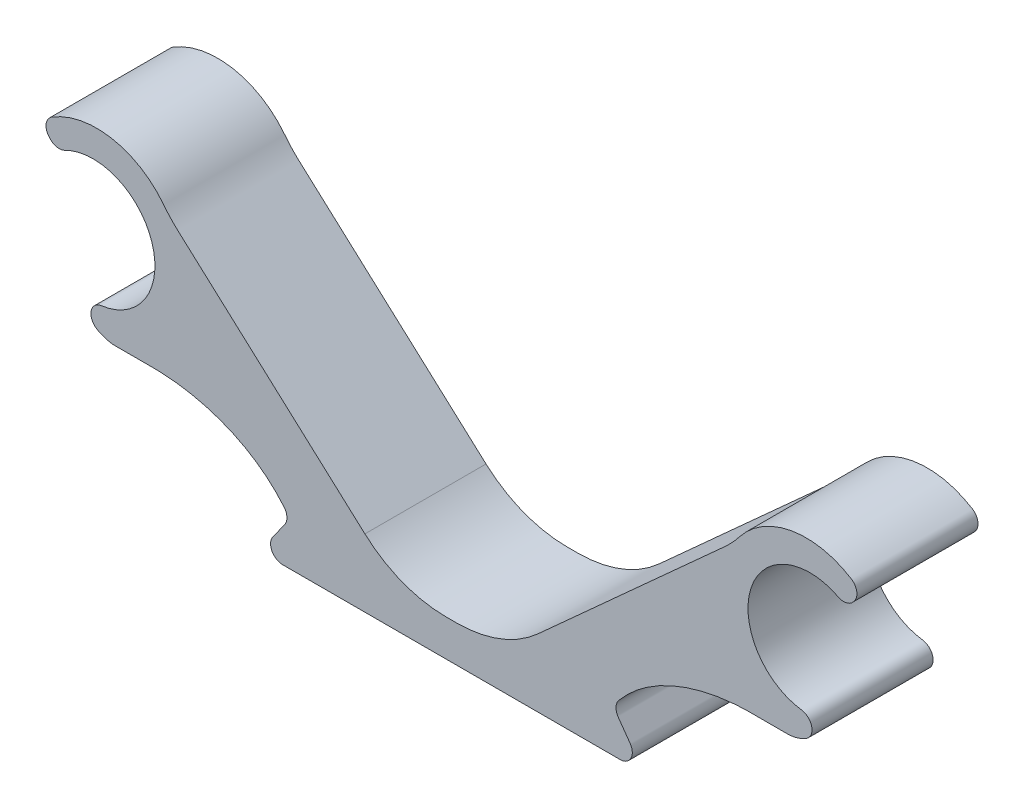
from build123d import *


with BuildPart() as part:
    # Sketch1 → Loft2 section 0
    with BuildSketch(Plane.XY):
        with BuildLine():
            Line((-14.749435925, 1.579146396), (-13.769485327, 2.95855378))
            ThreePointArc((-13.769485327, 2.95855378), (-13.585390404, 3.574613199), (-13.814433877, 4.175412031))
            add(Edge.make_bspline(
                [(-13.814433877, 4.175412031), (-14.417527952, 4.903873153), (-17.567781248, 7.791225194), (-22.06162275, 8.841915434), (-25.318719368, 8.741869045)],
                knots=[0.056598746, 0.056598746, 0.056598746, 0.056598746, 0.264504946, 1, 1, 1, 1], degree=3))
            Line((-25.318719368, 8.741869045), (-27.784310983, 8.741869045))
            add(Edge.make_bspline(
                [(-29.323229714, 9.211162218), (-28.911734347, 8.939401458), (-28.272403474, 8.743384076), (-27.784310983, 8.741869045)],
                knots=[0.586596628, 0.586596628, 0.586596628, 0.586596628, 1, 1, 1, 1], degree=3))
            ThreePointArc((-29.323229714, 9.211162218), (-29.747065132, 10.268151444), (-28.906559125, 11.036534382))
            ThreePointArc((-28.906559125, 11.036534382), (-24.721817141, 17.633736944), (-31.933702711, 20.637709922))
            ThreePointArc((-31.933702711, 20.637709922), (-32.573936169, 20.54323377), (-33.137949221, 20.860588307))
            Line((-33.137949221, 20.860588307), (-33.224181658, 20.957186689))
            ThreePointArc((-33.224181658, 20.957186689), (-33.468334903, 21.763124392), (-33.010324904, 22.46978784))
            ThreePointArc((-33.010324904, 22.46978784), (-28.072687528, 23.43565364), (-23.764465571, 20.837118829))
            ThreePointArc((-23.764465571, 20.837118829), (-23.196744837, 20.168506773), (-22.572618747, 19.552215012))
            Line((-22.572618747, 19.552215012), (-7.145865193, 5.601063972))
            ThreePointArc((-7.145865193, 5.601063972), (-4.032245088, 3.686045747), (-0.43842089, 3.017949499))
            Line((-0.43842089, 3.017949499), (0.43842089, 3.017949499))
            ThreePointArc((0.43842089, 3.017949499), (4.032245088, 3.686045747), (7.145865193, 5.601063972))
            Line((7.145865193, 5.601063972), (22.572618747, 19.552215012))
            ThreePointArc((22.572618747, 19.552215012), (23.196744837, 20.168506773), (23.764465571, 20.837118829))
            ThreePointArc((23.764465571, 20.837118829), (28.072687528, 23.43565364), (33.010324904, 22.46978784))
            ThreePointArc((33.010324904, 22.46978784), (33.468334903, 21.763124392), (33.224181658, 20.957186689))
            Line((33.224181658, 20.957186689), (33.137949221, 20.860588307))
            ThreePointArc((33.137949221, 20.860588307), (32.573936169, 20.54323377), (31.933702711, 20.637709922))
            ThreePointArc((31.933702711, 20.637709922), (24.721817141, 17.633736944), (28.906559125, 11.036534382))
            ThreePointArc((28.906559125, 11.036534382), (29.747065132, 10.268151444), (29.323229714, 9.211162218))
            add(Edge.make_bspline(
                [(29.323229714, 9.211162218), (28.911734347, 8.939401458), (28.272403474, 8.743384076), (27.784310983, 8.741869045)],
                knots=[0.586596628, 0.586596628, 0.586596628, 0.586596628, 1, 1, 1, 1], degree=3))
            Line((27.784310983, 8.741869045), (25.318719368, 8.741869045))
            add(Edge.make_bspline(
                [(13.814433877, 4.175412031), (14.417527952, 4.903873153), (17.567781248, 7.791225194), (22.06162275, 8.841915434), (25.318719368, 8.741869045)],
                knots=[0.056598746, 0.056598746, 0.056598746, 0.056598746, 0.264504946, 1, 1, 1, 1], degree=3))
            ThreePointArc((13.814433877, 4.175412031), (13.585390404, 3.574613199), (13.769485327, 2.95855378))
            Line((13.769485327, 2.95855378), (14.749435925, 1.579146396))
            ThreePointArc((14.749435925, 1.579146396), (14.822791679, 0.541276988), (13.934212365, 0))
            Line((13.934212365, 0), (-13.934212365, 0))
            ThreePointArc((-13.934212365, 0), (-14.822791679, 0.541276988), (-14.749435925, 1.579146396))
        make_face()
    # Sketch7 → Loft2 section 1
    with BuildSketch(Plane.XY.offset(10)):
        with BuildLine():
            Line((-14.749435925, 1.579146396), (-13.769485327, 2.95855378))
            ThreePointArc((-13.769485327, 2.95855378), (-13.585390404, 3.574613199), (-13.814433877, 4.175412031))
            add(Edge.make_bspline(
                [(-13.814433877, 4.175412031), (-14.417527952, 4.903873153), (-17.567781248, 7.791225194), (-22.06162275, 8.841915434), (-25.318719368, 8.741869045)],
                knots=[0.056598746, 0.056598746, 0.056598746, 0.056598746, 0.264504946, 1, 1, 1, 1], degree=3))
            Line((-25.318719368, 8.741869045), (-27.784310983, 8.741869045))
            add(Edge.make_bspline(
                [(-29.323229714, 9.211162218), (-28.911734347, 8.939401458), (-28.272403474, 8.743384076), (-27.784310983, 8.741869045)],
                knots=[0.586596628, 0.586596628, 0.586596628, 0.586596628, 1, 1, 1, 1], degree=3))
            ThreePointArc((-29.323229714, 9.211162218), (-29.747065132, 10.268151444), (-28.906559125, 11.036534382))
            ThreePointArc((-28.906559125, 11.036534382), (-24.721817141, 17.633736944), (-31.933702711, 20.637709922))
            ThreePointArc((-31.933702711, 20.637709922), (-32.573936169, 20.54323377), (-33.137949221, 20.860588307))
            Line((-33.137949221, 20.860588307), (-33.224181658, 20.957186689))
            ThreePointArc((-33.224181658, 20.957186689), (-33.468334903, 21.763124392), (-33.010324904, 22.46978784))
            ThreePointArc((-33.010324904, 22.46978784), (-28.072687528, 23.43565364), (-23.764465571, 20.837118829))
            ThreePointArc((-23.764465571, 20.837118829), (-23.196744837, 20.168506773), (-22.572618747, 19.552215012))
            Line((-22.572618747, 19.552215012), (-7.145865193, 5.601063972))
            ThreePointArc((-7.145865193, 5.601063972), (-4.032245088, 3.686045747), (-0.43842089, 3.017949499))
            Line((-0.43842089, 3.017949499), (0.43842089, 3.017949499))
            ThreePointArc((0.43842089, 3.017949499), (4.032245088, 3.686045747), (7.145865193, 5.601063972))
            Line((7.145865193, 5.601063972), (22.572618747, 19.552215012))
            ThreePointArc((22.572618747, 19.552215012), (23.196744837, 20.168506773), (23.764465571, 20.837118829))
            ThreePointArc((23.764465571, 20.837118829), (28.072687528, 23.43565364), (33.010324904, 22.46978784))
            ThreePointArc((33.010324904, 22.46978784), (33.468334903, 21.763124392), (33.224181658, 20.957186689))
            Line((33.224181658, 20.957186689), (33.137949221, 20.860588307))
            ThreePointArc((33.137949221, 20.860588307), (32.573936169, 20.54323377), (31.933702711, 20.637709922))
            ThreePointArc((31.933702711, 20.637709922), (24.721817141, 17.633736944), (28.906559125, 11.036534382))
            ThreePointArc((28.906559125, 11.036534382), (29.747065132, 10.268151444), (29.323229714, 9.211162218))
            add(Edge.make_bspline(
                [(29.323229714, 9.211162218), (28.911734347, 8.939401458), (28.272403474, 8.743384076), (27.784310983, 8.741869045)],
                knots=[0.586596628, 0.586596628, 0.586596628, 0.586596628, 1, 1, 1, 1], degree=3))
            Line((27.784310983, 8.741869045), (25.318719368, 8.741869045))
            add(Edge.make_bspline(
                [(13.814433877, 4.175412031), (14.417527952, 4.903873153), (17.567781248, 7.791225194), (22.06162275, 8.841915434), (25.318719368, 8.741869045)],
                knots=[0.056598746, 0.056598746, 0.056598746, 0.056598746, 0.264504946, 1, 1, 1, 1], degree=3))
            ThreePointArc((13.814433877, 4.175412031), (13.585390404, 3.574613199), (13.769485327, 2.95855378))
            Line((13.769485327, 2.95855378), (14.749435925, 1.579146396))
            ThreePointArc((14.749435925, 1.579146396), (14.822791679, 0.541276988), (13.934212365, 0))
            Line((13.934212365, 0), (-13.934212365, 0))
            ThreePointArc((-13.934212365, 0), (-14.822791679, 0.541276988), (-14.749435925, 1.579146396))
        make_face()
    loft()


solid = part.part
